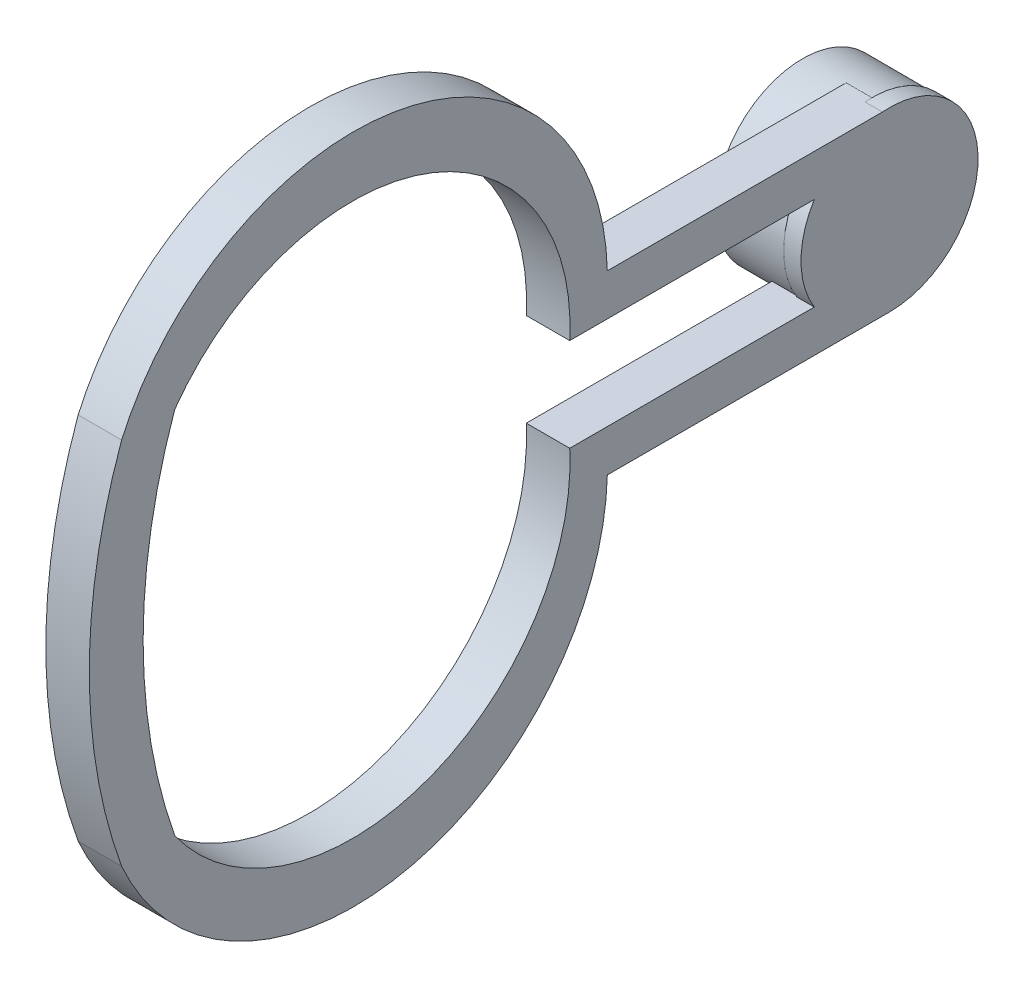
from build123d import *

# Parameters (mm, degrees)
BOSS_EXTRUDE6_DEPTH         = 1.524
BOSS_EXTRUDE6_DEPTH_BACK    = 3.048
SKETCH5_R                   = 0.127
BOSS_EXTRUDE6_2_DEPTH       = 1.524
BOSS_EXTRUDE6_2_DEPTH_BACK  = 3.048
BOSS_EXTRUDE6_3_DEPTH       = 1.524
BOSS_EXTRUDE6_3_DEPTH_BACK  = 3.048
BOSS_EXTRUDE6_4_DEPTH       = 1.524
BOSS_EXTRUDE6_4_DEPTH_BACK  = 3.048
BOSS_EXTRUDE6_5_DEPTH       = 1.524
BOSS_EXTRUDE6_5_DEPTH_BACK  = 3.048
BOSS_EXTRUDE6_6_DEPTH       = 1.524
BOSS_EXTRUDE6_6_DEPTH_BACK  = 3.048
BOSS_EXTRUDE6_7_DEPTH       = 1.524
BOSS_EXTRUDE6_7_DEPTH_BACK  = 3.048
BOSS_EXTRUDE6_8_DEPTH       = 1.524
BOSS_EXTRUDE6_8_DEPTH_BACK  = 3.048
BOSS_EXTRUDE6_9_DEPTH       = 1.524
BOSS_EXTRUDE6_9_DEPTH_BACK  = 3.048
BOSS_EXTRUDE6_10_DEPTH      = 1.524
BOSS_EXTRUDE6_10_DEPTH_BACK = 3.048
BOSS_EXTRUDE6_11_DEPTH      = 1.524
BOSS_EXTRUDE6_11_DEPTH_BACK = 3.048
BOSS_EXTRUDE6_12_DEPTH      = 1.524
BOSS_EXTRUDE6_12_DEPTH_BACK = 3.048
BOSS_EXTRUDE6_13_DEPTH      = 1.524
BOSS_EXTRUDE6_13_DEPTH_BACK = 3.048
BOSS_EXTRUDE6_14_DEPTH      = 1.524
BOSS_EXTRUDE6_14_DEPTH_BACK = 3.048
BOSS_EXTRUDE6_15_DEPTH      = 1.524
BOSS_EXTRUDE6_15_DEPTH_BACK = 3.048
BOSS_EXTRUDE6_16_DEPTH      = 1.524
BOSS_EXTRUDE6_16_DEPTH_BACK = 3.048
BOSS_EXTRUDE6_17_DEPTH      = 1.524
BOSS_EXTRUDE6_17_DEPTH_BACK = 3.048
BOSS_EXTRUDE6_18_DEPTH      = 1.524
BOSS_EXTRUDE6_18_DEPTH_BACK = 3.048
BOSS_EXTRUDE6_19_DEPTH      = 1.524
BOSS_EXTRUDE6_19_DEPTH_BACK = 3.048
BOSS_EXTRUDE6_20_DEPTH      = 1.524
BOSS_EXTRUDE6_20_DEPTH_BACK = 3.048
BOSS_EXTRUDE6_21_DEPTH      = 1.524
BOSS_EXTRUDE6_21_DEPTH_BACK = 3.048
BOSS_EXTRUDE6_22_DEPTH      = 1.524
BOSS_EXTRUDE6_22_DEPTH_BACK = 3.048
BOSS_EXTRUDE6_23_DEPTH      = 1.524
BOSS_EXTRUDE6_23_DEPTH_BACK = 3.048
BOSS_EXTRUDE6_24_DEPTH      = 1.524
BOSS_EXTRUDE6_24_DEPTH_BACK = 3.048
BOSS_EXTRUDE6_25_DEPTH      = 1.524
BOSS_EXTRUDE6_25_DEPTH_BACK = 3.048
BOSS_EXTRUDE6_26_DEPTH      = 1.524
BOSS_EXTRUDE6_26_DEPTH_BACK = 3.048
BOSS_EXTRUDE6_27_DEPTH      = 1.524
BOSS_EXTRUDE6_27_DEPTH_BACK = 3.048
BOSS_EXTRUDE6_28_DEPTH      = 1.524
BOSS_EXTRUDE6_28_DEPTH_BACK = 3.048
BOSS_EXTRUDE6_29_DEPTH      = 1.524
BOSS_EXTRUDE6_29_DEPTH_BACK = 3.048
BOSS_EXTRUDE6_30_DEPTH      = 1.524
BOSS_EXTRUDE6_30_DEPTH_BACK = 3.048
BOSS_EXTRUDE6_31_DEPTH      = 1.524
BOSS_EXTRUDE6_31_DEPTH_BACK = 3.048
BOSS_EXTRUDE6_32_DEPTH      = 1.524
BOSS_EXTRUDE6_32_DEPTH_BACK = 3.048
BOSS_EXTRUDE6_33_DEPTH      = 1.524
BOSS_EXTRUDE6_33_DEPTH_BACK = 3.048
BOSS_EXTRUDE6_34_DEPTH      = 1.524
BOSS_EXTRUDE6_34_DEPTH_BACK = 3.048
BOSS_EXTRUDE6_35_DEPTH      = 1.524
BOSS_EXTRUDE6_35_DEPTH_BACK = 3.048
SKETCH10_R                  = 0.7239
BOSS_EXTRUDE13_DEPTH        = 4.572
BOSS_EXTRUDE9_DEPTH         = 1.524
BOSS_EXTRUDE9_DEPTH_BACK    = 1.016
SKETCH9_R                   = 5.173086185
BOSS_EXTRUDE10_DEPTH        = 1.016
SKETCH12_R                  = 5.111318418
SKETCH12_R_2                = 2.242435501
BOSS_EXTRUDE15_DEPTH        = 4.064
SKETCH13_R                  = 3.696925513
CUT_EXTRUDE1_DEPTH          = 4.572


with BuildPart() as part:
    # Sketch5 → Boss-Extrude6 (new, two sides: drawn at the far end of the back side and taken through both)
    with BuildSketch(Plane(origin=(0, 0, 0), x_dir=(0, 0, -1), z_dir=(1, 0, 0)).offset(-BOSS_EXTRUDE6_DEPTH_BACK)):
        with Locations((0.334697735, 2.224969992)):
            Circle(SKETCH5_R)
    extrude(amount=BOSS_EXTRUDE6_DEPTH + BOSS_EXTRUDE6_DEPTH_BACK)


with BuildPart() as body_2:
    # Sketch5 → Boss-Extrude6 2 (new, two sides: drawn at the far end of the back side and taken through both)
    with BuildSketch(Plane(origin=(0, 0, 0), x_dir=(0, 0, -1), z_dir=(1, 0, 0)).offset(-BOSS_EXTRUDE6_2_DEPTH_BACK)):
        with Locations((0.726602738, 2.129451221)):
            Circle(SKETCH5_R)
    extrude(amount=BOSS_EXTRUDE6_2_DEPTH + BOSS_EXTRUDE6_2_DEPTH_BACK)


with BuildPart() as body_3:
    # Sketch5 → Boss-Extrude6 3 (new, two sides: drawn at the far end of the back side and taken through both)
    with BuildSketch(Plane(origin=(0, 0, 0), x_dir=(0, 0, -1), z_dir=(1, 0, 0)).offset(-BOSS_EXTRUDE6_3_DEPTH_BACK)):
        with Locations((1.09515413, 1.965490135)):
            Circle(SKETCH5_R)
    extrude(amount=BOSS_EXTRUDE6_3_DEPTH + BOSS_EXTRUDE6_3_DEPTH_BACK)


with BuildPart() as body_4:
    # Sketch5 → Boss-Extrude6 4 (new, two sides: drawn at the far end of the back side and taken through both)
    with BuildSketch(Plane(origin=(0, 0, 0), x_dir=(0, 0, -1), z_dir=(1, 0, 0)).offset(-BOSS_EXTRUDE6_4_DEPTH_BACK)):
        with Locations((1.428506368, 1.738356579)):
            Circle(SKETCH5_R)
    extrude(amount=BOSS_EXTRUDE6_4_DEPTH + BOSS_EXTRUDE6_4_DEPTH_BACK)


with BuildPart() as body_5:
    # Sketch5 → Boss-Extrude6 5 (new, two sides: drawn at the far end of the back side and taken through both)
    with BuildSketch(Plane(origin=(0, 0, 0), x_dir=(0, 0, -1), z_dir=(1, 0, 0)).offset(-BOSS_EXTRUDE6_5_DEPTH_BACK)):
        with Locations((1.715945236, 1.455350812)):
            Circle(SKETCH5_R)
    extrude(amount=BOSS_EXTRUDE6_5_DEPTH + BOSS_EXTRUDE6_5_DEPTH_BACK)


with BuildPart() as body_6:
    # Sketch5 → Boss-Extrude6 6 (new, two sides: drawn at the far end of the back side and taken through both)
    with BuildSketch(Plane(origin=(0, 0, 0), x_dir=(0, 0, -1), z_dir=(1, 0, 0)).offset(-BOSS_EXTRUDE6_6_DEPTH_BACK)):
        with Locations((1.948232212, 1.125568873)):
            Circle(SKETCH5_R)
    extrude(amount=BOSS_EXTRUDE6_6_DEPTH + BOSS_EXTRUDE6_6_DEPTH_BACK)


with BuildPart() as body_7:
    # Sketch5 → Boss-Extrude6 7 (new, two sides: drawn at the far end of the back side and taken through both)
    with BuildSketch(Plane(origin=(0, 0, 0), x_dir=(0, 0, -1), z_dir=(1, 0, 0)).offset(-BOSS_EXTRUDE6_7_DEPTH_BACK)):
        with Locations((2.117901402, 0.759610224)):
            Circle(SKETCH5_R)
    extrude(amount=BOSS_EXTRUDE6_7_DEPTH + BOSS_EXTRUDE6_7_DEPTH_BACK)


with BuildPart() as body_8:
    # Sketch5 → Boss-Extrude6 8 (new, two sides: drawn at the far end of the back side and taken through both)
    with BuildSketch(Plane(origin=(0, 0, 0), x_dir=(0, 0, -1), z_dir=(1, 0, 0)).offset(-BOSS_EXTRUDE6_8_DEPTH_BACK)):
        with Locations((2.219499498, 0.369237078)):
            Circle(SKETCH5_R)
    extrude(amount=BOSS_EXTRUDE6_8_DEPTH + BOSS_EXTRUDE6_8_DEPTH_BACK)


with BuildPart() as body_9:
    # Sketch5 → Boss-Extrude6 9 (new, two sides: drawn at the far end of the back side and taken through both)
    with BuildSketch(Plane(origin=(0, 0, 0), x_dir=(0, 0, -1), z_dir=(1, 0, 0)).offset(-BOSS_EXTRUDE6_9_DEPTH_BACK)):
        with Locations((2.249761054, -0.033003652)):
            Circle(SKETCH5_R)
    extrude(amount=BOSS_EXTRUDE6_9_DEPTH + BOSS_EXTRUDE6_9_DEPTH_BACK)


with BuildPart() as body_10:
    # Sketch5 → Boss-Extrude6 10 (new, two sides: drawn at the far end of the back side and taken through both)
    with BuildSketch(Plane(origin=(0, 0, 0), x_dir=(0, 0, -1), z_dir=(1, 0, 0)).offset(-BOSS_EXTRUDE6_10_DEPTH_BACK)):
        with Locations((2.207713438, -0.434183618)):
            Circle(SKETCH5_R)
    extrude(amount=BOSS_EXTRUDE6_10_DEPTH + BOSS_EXTRUDE6_10_DEPTH_BACK)


with BuildPart() as body_11:
    # Sketch5 → Boss-Extrude6 11 (new, two sides: drawn at the far end of the back side and taken through both)
    with BuildSketch(Plane(origin=(0, 0, 0), x_dir=(0, 0, -1), z_dir=(1, 0, 0)).offset(-BOSS_EXTRUDE6_11_DEPTH_BACK)):
        with Locations((2.094708097, -0.821408565)):
            Circle(SKETCH5_R)
    extrude(amount=BOSS_EXTRUDE6_11_DEPTH + BOSS_EXTRUDE6_11_DEPTH_BACK)


with BuildPart() as body_12:
    # Sketch5 → Boss-Extrude6 12 (new, two sides: drawn at the far end of the back side and taken through both)
    with BuildSketch(Plane(origin=(0, 0, 0), x_dir=(0, 0, -1), z_dir=(1, 0, 0)).offset(-BOSS_EXTRUDE6_12_DEPTH_BACK)):
        with Locations((1.914377113, -1.182232764)):
            Circle(SKETCH5_R)
    extrude(amount=BOSS_EXTRUDE6_12_DEPTH + BOSS_EXTRUDE6_12_DEPTH_BACK)


with BuildPart() as body_13:
    # Sketch5 → Boss-Extrude6 13 (new, two sides: drawn at the far end of the back side and taken through both)
    with BuildSketch(Plane(origin=(0, 0, 0), x_dir=(0, 0, -1), z_dir=(1, 0, 0)).offset(-BOSS_EXTRUDE6_13_DEPTH_BACK)):
        with Locations((1.672516474, -1.50505903)):
            Circle(SKETCH5_R)
    extrude(amount=BOSS_EXTRUDE6_13_DEPTH + BOSS_EXTRUDE6_13_DEPTH_BACK)


with BuildPart() as body_14:
    # Sketch5 → Boss-Extrude6 14 (new, two sides: drawn at the far end of the back side and taken through both)
    with BuildSketch(Plane(origin=(0, 0, 0), x_dir=(0, 0, -1), z_dir=(1, 0, 0)).offset(-BOSS_EXTRUDE6_14_DEPTH_BACK)):
        with Locations((1.376899779, -1.779511461)):
            Circle(SKETCH5_R)
    extrude(amount=BOSS_EXTRUDE6_14_DEPTH + BOSS_EXTRUDE6_14_DEPTH_BACK)


with BuildPart() as body_15:
    # Sketch5 → Boss-Extrude6 15 (new, two sides: drawn at the far end of the back side and taken through both)
    with BuildSketch(Plane(origin=(0, 0, 0), x_dir=(0, 0, -1), z_dir=(1, 0, 0)).offset(-BOSS_EXTRUDE6_15_DEPTH_BACK)):
        with Locations((1.037028393, -1.996768928)):
            Circle(SKETCH5_R)
    extrude(amount=BOSS_EXTRUDE6_15_DEPTH + BOSS_EXTRUDE6_15_DEPTH_BACK)


with BuildPart() as body_16:
    # Sketch5 → Boss-Extrude6 16 (new, two sides: drawn at the far end of the back side and taken through both)
    with BuildSketch(Plane(origin=(0, 0, 0), x_dir=(0, 0, -1), z_dir=(1, 0, 0)).offset(-BOSS_EXTRUDE6_16_DEPTH_BACK)):
        with Locations((0.66382606, -2.1498486)):
            Circle(SKETCH5_R)
    extrude(amount=BOSS_EXTRUDE6_16_DEPTH + BOSS_EXTRUDE6_16_DEPTH_BACK)


with BuildPart() as body_17:
    # Sketch5 → Boss-Extrude6 17 (new, two sides: drawn at the far end of the back side and taken through both)
    with BuildSketch(Plane(origin=(0, 0, 0), x_dir=(0, 0, -1), z_dir=(1, 0, 0)).offset(-BOSS_EXTRUDE6_17_DEPTH_BACK)):
        with Locations((0.269287812, -2.233830368)):
            Circle(SKETCH5_R)
    extrude(amount=BOSS_EXTRUDE6_17_DEPTH + BOSS_EXTRUDE6_17_DEPTH_BACK)


with BuildPart() as body_18:
    # Sketch5 → Boss-Extrude6 18 (new, two sides: drawn at the far end of the back side and taken through both)
    with BuildSketch(Plane(origin=(0, 0, 0), x_dir=(0, 0, -1), z_dir=(1, 0, 0)).offset(-BOSS_EXTRUDE6_18_DEPTH_BACK)):
        with Locations((-0.133905568, -2.246014991)):
            Circle(SKETCH5_R)
    extrude(amount=BOSS_EXTRUDE6_18_DEPTH + BOSS_EXTRUDE6_18_DEPTH_BACK)


with BuildPart() as body_19:
    # Sketch5 → Boss-Extrude6 19 (new, two sides: drawn at the far end of the back side and taken through both)
    with BuildSketch(Plane(origin=(0, 0, 0), x_dir=(0, 0, -1), z_dir=(1, 0, 0)).offset(-BOSS_EXTRUDE6_19_DEPTH_BACK)):
        with Locations((-0.532795113, -2.186010843)):
            Circle(SKETCH5_R)
    extrude(amount=BOSS_EXTRUDE6_19_DEPTH + BOSS_EXTRUDE6_19_DEPTH_BACK)


with BuildPart() as body_20:
    # Sketch5 → Boss-Extrude6 20 (new, two sides: drawn at the far end of the back side and taken through both)
    with BuildSketch(Plane(origin=(0, 0, 0), x_dir=(0, 0, -1), z_dir=(1, 0, 0)).offset(-BOSS_EXTRUDE6_20_DEPTH_BACK)):
        with Locations((-0.914560184, -2.055746509)):
            Circle(SKETCH5_R)
    extrude(amount=BOSS_EXTRUDE6_20_DEPTH + BOSS_EXTRUDE6_20_DEPTH_BACK)


with BuildPart() as body_21:
    # Sketch5 → Boss-Extrude6 21 (new, two sides: drawn at the far end of the back side and taken through both)
    with BuildSketch(Plane(origin=(0, 0, 0), x_dir=(0, 0, -1), z_dir=(1, 0, 0)).offset(-BOSS_EXTRUDE6_21_DEPTH_BACK)):
        with Locations((-1.266930539, -1.85940879)):
            Circle(SKETCH5_R)
    extrude(amount=BOSS_EXTRUDE6_21_DEPTH + BOSS_EXTRUDE6_21_DEPTH_BACK)


with BuildPart() as body_22:
    # Sketch5 → Boss-Extrude6 22 (new, two sides: drawn at the far end of the back side and taken through both)
    with BuildSketch(Plane(origin=(0, 0, 0), x_dir=(0, 0, -1), z_dir=(1, 0, 0)).offset(-BOSS_EXTRUDE6_22_DEPTH_BACK)):
        with Locations((-1.578580704, -1.603308143)):
            Circle(SKETCH5_R)
    extrude(amount=BOSS_EXTRUDE6_22_DEPTH + BOSS_EXTRUDE6_22_DEPTH_BACK)


with BuildPart() as body_23:
    # Sketch5 → Boss-Extrude6 23 (new, two sides: drawn at the far end of the back side and taken through both)
    with BuildSketch(Plane(origin=(0, 0, 0), x_dir=(0, 0, -1), z_dir=(1, 0, 0)).offset(-BOSS_EXTRUDE6_23_DEPTH_BACK)):
        with Locations((-1.839493986, -1.295675853)):
            Circle(SKETCH5_R)
    extrude(amount=BOSS_EXTRUDE6_23_DEPTH + BOSS_EXTRUDE6_23_DEPTH_BACK)


with BuildPart() as body_24:
    # Sketch5 → Boss-Extrude6 24 (new, two sides: drawn at the far end of the back side and taken through both)
    with BuildSketch(Plane(origin=(0, 0, 0), x_dir=(0, 0, -1), z_dir=(1, 0, 0)).offset(-BOSS_EXTRUDE6_24_DEPTH_BACK)):
        with Locations((-2.041284418, -0.946399475)):
            Circle(SKETCH5_R)
    extrude(amount=BOSS_EXTRUDE6_24_DEPTH + BOSS_EXTRUDE6_24_DEPTH_BACK)


with BuildPart() as body_25:
    # Sketch5 → Boss-Extrude6 25 (new, two sides: drawn at the far end of the back side and taken through both)
    with BuildSketch(Plane(origin=(0, 0, 0), x_dir=(0, 0, -1), z_dir=(1, 0, 0)).offset(-BOSS_EXTRUDE6_25_DEPTH_BACK)):
        with Locations((-2.177466289, -0.566705039)):
            Circle(SKETCH5_R)
    extrude(amount=BOSS_EXTRUDE6_25_DEPTH + BOSS_EXTRUDE6_25_DEPTH_BACK)


with BuildPart() as body_26:
    # Sketch5 → Boss-Extrude6 26 (new, two sides: drawn at the far end of the back side and taken through both)
    with BuildSketch(Plane(origin=(0, 0, 0), x_dir=(0, 0, -1), z_dir=(1, 0, 0)).offset(-BOSS_EXTRUDE6_26_DEPTH_BACK)):
        with Locations((-2.243662602, -0.168796237)):
            Circle(SKETCH5_R)
    extrude(amount=BOSS_EXTRUDE6_26_DEPTH + BOSS_EXTRUDE6_26_DEPTH_BACK)


with BuildPart() as body_27:
    # Sketch5 → Boss-Extrude6 27 (new, two sides: drawn at the far end of the back side and taken through both)
    with BuildSketch(Plane(origin=(0, 0, 0), x_dir=(0, 0, -1), z_dir=(1, 0, 0)).offset(-BOSS_EXTRUDE6_27_DEPTH_BACK)):
        with Locations((-2.237745753, 0.234537815)):
            Circle(SKETCH5_R)
    extrude(amount=BOSS_EXTRUDE6_27_DEPTH + BOSS_EXTRUDE6_27_DEPTH_BACK)


with BuildPart() as body_28:
    # Sketch5 → Boss-Extrude6 28 (new, two sides: drawn at the far end of the back side and taken through both)
    with BuildSketch(Plane(origin=(0, 0, 0), x_dir=(0, 0, -1), z_dir=(1, 0, 0)).offset(-BOSS_EXTRUDE6_28_DEPTH_BACK)):
        with Locations((-2.159905914, 0.630333629)):
            Circle(SKETCH5_R)
    extrude(amount=BOSS_EXTRUDE6_28_DEPTH + BOSS_EXTRUDE6_28_DEPTH_BACK)


with BuildPart() as body_29:
    # Sketch5 → Boss-Extrude6 29 (new, two sides: drawn at the far end of the back side and taken through both)
    with BuildSketch(Plane(origin=(0, 0, 0), x_dir=(0, 0, -1), z_dir=(1, 0, 0)).offset(-BOSS_EXTRUDE6_29_DEPTH_BACK)):
        with Locations((-2.012644922, 1.005870001)):
            Circle(SKETCH5_R)
    extrude(amount=BOSS_EXTRUDE6_29_DEPTH + BOSS_EXTRUDE6_29_DEPTH_BACK)


with BuildPart() as body_30:
    # Sketch5 → Boss-Extrude6 30 (new, two sides: drawn at the far end of the back side and taken through both)
    with BuildSketch(Plane(origin=(0, 0, 0), x_dir=(0, 0, -1), z_dir=(1, 0, 0)).offset(-BOSS_EXTRUDE6_30_DEPTH_BACK)):
        with Locations((-1.800695866, 1.349076884)):
            Circle(SKETCH5_R)
    extrude(amount=BOSS_EXTRUDE6_30_DEPTH + BOSS_EXTRUDE6_30_DEPTH_BACK)


with BuildPart() as body_31:
    # Sketch5 → Boss-Extrude6 31 (new, two sides: drawn at the far end of the back side and taken through both)
    with BuildSketch(Plane(origin=(0, 0, 0), x_dir=(0, 0, -1), z_dir=(1, 0, 0)).offset(-BOSS_EXTRUDE6_31_DEPTH_BACK)):
        with Locations((-1.530870963, 1.648923326)):
            Circle(SKETCH5_R)
    extrude(amount=BOSS_EXTRUDE6_31_DEPTH + BOSS_EXTRUDE6_31_DEPTH_BACK)


with BuildPart() as body_32:
    # Sketch5 → Boss-Extrude6 32 (new, two sides: drawn at the far end of the back side and taken through both)
    with BuildSketch(Plane(origin=(0, 0, 0), x_dir=(0, 0, -1), z_dir=(1, 0, 0)).offset(-BOSS_EXTRUDE6_32_DEPTH_BACK)):
        with Locations((-1.211842608, 1.895772015)):
            Circle(SKETCH5_R)
    extrude(amount=BOSS_EXTRUDE6_32_DEPTH + BOSS_EXTRUDE6_32_DEPTH_BACK)


with BuildPart() as body_33:
    # Sketch5 → Boss-Extrude6 33 (new, two sides: drawn at the far end of the back side and taken through both)
    with BuildSketch(Plane(origin=(0, 0, 0), x_dir=(0, 0, -1), z_dir=(1, 0, 0)).offset(-BOSS_EXTRUDE6_33_DEPTH_BACK)):
        with Locations((-0.853864634, 2.081689032)):
            Circle(SKETCH5_R)
    extrude(amount=BOSS_EXTRUDE6_33_DEPTH + BOSS_EXTRUDE6_33_DEPTH_BACK)


with BuildPart() as body_34:
    # Sketch5 → Boss-Extrude6 34 (new, two sides: drawn at the far end of the back side and taken through both)
    with BuildSketch(Plane(origin=(0, 0, 0), x_dir=(0, 0, -1), z_dir=(1, 0, 0)).offset(-BOSS_EXTRUDE6_34_DEPTH_BACK)):
        with Locations((-0.468442749, 2.200698851)):
            Circle(SKETCH5_R)
    extrude(amount=BOSS_EXTRUDE6_34_DEPTH + BOSS_EXTRUDE6_34_DEPTH_BACK)


with BuildPart() as body_35:
    # Sketch5 → Boss-Extrude6 35 (new, two sides: drawn at the far end of the back side and taken through both)
    with BuildSketch(Plane(origin=(0, 0, 0), x_dir=(0, 0, -1), z_dir=(1, 0, 0)).offset(-BOSS_EXTRUDE6_35_DEPTH_BACK)):
        with Locations((-0.067964728, 2.248976397)):
            Circle(SKETCH5_R)
    extrude(amount=BOSS_EXTRUDE6_35_DEPTH + BOSS_EXTRUDE6_35_DEPTH_BACK)


with BuildPart() as body_36:
    # Sketch10 → Boss-Extrude13 (new body)
    with BuildSketch(Plane.ZY.offset(3.048)):
        Circle(SKETCH10_R)
    extrude(amount=-BOSS_EXTRUDE13_DEPTH)


with BuildPart() as body_37:
    # Sketch8 → Boss-Extrude9 (new, two sides: drawn at the far end of the back side and taken through both)
    with BuildSketch(Plane.ZY.offset(-1.016).offset(-BOSS_EXTRUDE9_DEPTH_BACK)):
        with BuildLine():
            Line((0, 2.72313354), (0, 5.15660667))
            Line((0, 5.15660667), (16.489901694, 5.15660667))
            ThreePointArc((16.489901694, 5.15660667), (28.426928424, 19.333087357), (44.871590883, 10.786843244))
            ThreePointArc((44.871590883, 10.786843244), (46.761990325, 0), (44.871590883, -10.786843244))
            ThreePointArc((44.871590883, -10.786843244), (28.435013717, -19.334688947), (16.490318564, -5.173086185))
            Line((16.490318564, -5.173086185), (0, -5.173086185))
            Line((0, -5.173086185), (0, -2.72313354))
            Line((0, -2.72313354), (18.686821052, -2.72313354))
            ThreePointArc((18.686821052, -2.72313354), (27.200110639, -15.417133446), (41.766309383, -10.786843244))
            ThreePointArc((41.766309383, -10.786843244), (43.616042203, 0), (41.766309383, 10.786843244))
            ThreePointArc((41.766309383, 10.786843244), (27.200110639, 15.417133446), (18.686821052, 2.72313354))
            Line((18.686821052, 2.72313354), (0, 2.72313354))
        make_face()
    extrude(amount=BOSS_EXTRUDE9_DEPTH + BOSS_EXTRUDE9_DEPTH_BACK)

    # Sketch9 → Boss-Extrude10 (add)
    with BuildSketch(Plane.ZY.offset(-1.016)):
        Circle(SKETCH9_R)
    extrude(amount=-BOSS_EXTRUDE10_DEPTH)


    add(part.part)  # Boss-Extrude15 merges part

    add(body_2.part)  # Boss-Extrude15 merges body 2

    add(body_3.part)  # Boss-Extrude15 merges body 3

    add(body_4.part)  # Boss-Extrude15 merges body 4

    add(body_5.part)  # Boss-Extrude15 merges body 5

    add(body_6.part)  # Boss-Extrude15 merges body 6

    add(body_7.part)  # Boss-Extrude15 merges body 7

    add(body_8.part)  # Boss-Extrude15 merges body 8

    add(body_9.part)  # Boss-Extrude15 merges body 9

    add(body_10.part)  # Boss-Extrude15 merges body 10

    add(body_11.part)  # Boss-Extrude15 merges body 11

    add(body_12.part)  # Boss-Extrude15 merges body 12

    add(body_13.part)  # Boss-Extrude15 merges body 13

    add(body_14.part)  # Boss-Extrude15 merges body 14

    add(body_15.part)  # Boss-Extrude15 merges body 15

    add(body_16.part)  # Boss-Extrude15 merges body 16

    add(body_17.part)  # Boss-Extrude15 merges body 17

    add(body_18.part)  # Boss-Extrude15 merges body 18

    add(body_19.part)  # Boss-Extrude15 merges body 19

    add(body_20.part)  # Boss-Extrude15 merges body 20

    add(body_21.part)  # Boss-Extrude15 merges body 21

    add(body_22.part)  # Boss-Extrude15 merges body 22

    add(body_23.part)  # Boss-Extrude15 merges body 23

    add(body_24.part)  # Boss-Extrude15 merges body 24

    add(body_25.part)  # Boss-Extrude15 merges body 25

    add(body_26.part)  # Boss-Extrude15 merges body 26

    add(body_27.part)  # Boss-Extrude15 merges body 27

    add(body_28.part)  # Boss-Extrude15 merges body 28

    add(body_29.part)  # Boss-Extrude15 merges body 29

    add(body_30.part)  # Boss-Extrude15 merges body 30

    add(body_31.part)  # Boss-Extrude15 merges body 31

    add(body_32.part)  # Boss-Extrude15 merges body 32

    add(body_33.part)  # Boss-Extrude15 merges body 33

    add(body_34.part)  # Boss-Extrude15 merges body 34

    add(body_35.part)  # Boss-Extrude15 merges body 35

    add(body_36.part)  # Boss-Extrude15 merges body 36
    # Sketch12 → Boss-Extrude15 (add)
    with BuildSketch(Plane.ZY.offset(-1.016)):
        with Locations(Location((0, 0, 0), (0, 0, 270))):
            Circle(SKETCH12_R)
        Circle(SKETCH12_R_2, mode=Mode.SUBTRACT)
    extrude(amount=BOSS_EXTRUDE15_DEPTH)

    # Sketch13 → Cut-Extrude1 (cut)
    with BuildSketch(Plane.ZY.offset(3.048)):
        Circle(SKETCH13_R)
    extrude(amount=-CUT_EXTRUDE1_DEPTH, mode=Mode.SUBTRACT)


solid = body_37.part
